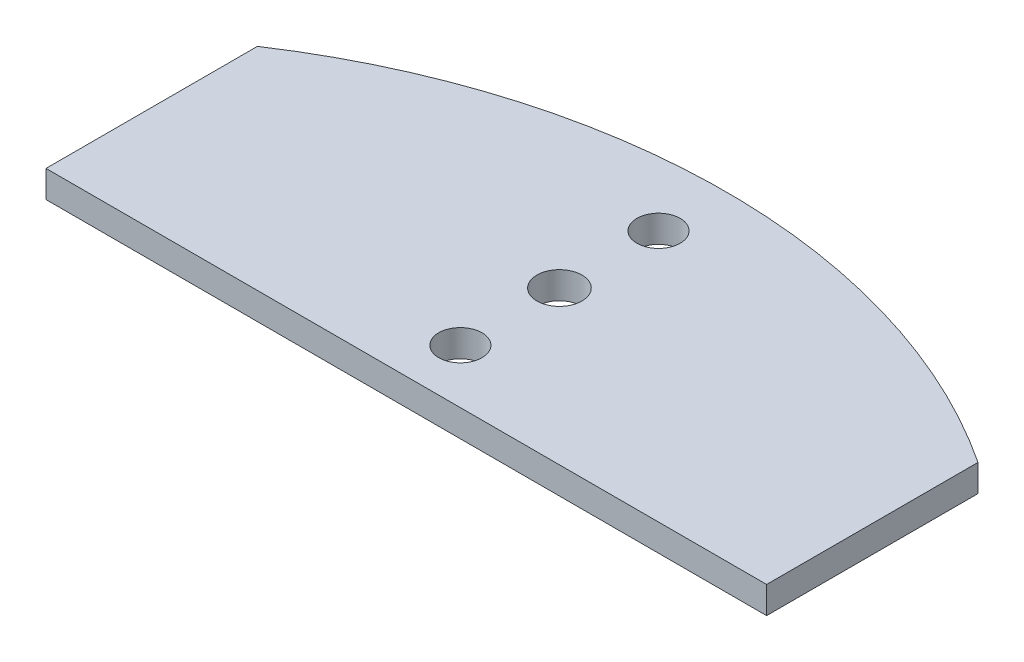
from build123d import *

# Parameters (mm, degrees)
BOSS_EXTRUDE1_DEPTH  = 3
SKETCH11_OUTSIDE_W   = 186.736
SKETCH11_OUTSIDE_H   = 177.534
SKETCH11_OUTSIDE_W_2 = 80
SKETCH11_OUTSIDE_H_2 = 40
CUT_EXTRUDE13_DEPTH  = 103.574363269
SKETCH12_R           = 2.4
CUT_EXTRUDE15_DEPTH  = 83.856804186
SKETCH13_R           = 2.5
CUT_EXTRUDE16_DEPTH  = 83.856804186


with BuildPart() as part:
    # Sketch1 → Boss-Extrude1 (new body)
    with BuildSketch(Plane(origin=(0, 0, 0), x_dir=(1, 0, 0), z_dir=(0, 1, 0))):
        with BuildLine():
            ThreePointArc((36.543377003, -62.616544118), (0, 72.5), (-36.543377003, -62.616544118))
            ThreePointArc((-36.543377003, -62.616544118), (-33.085954668, -63.20954405), (-30.089832649, -61.38507948))
            ThreePointArc((-30.089832649, -61.38507948), (0, -46.75), (30.089832649, -61.38507948))
            ThreePointArc((30.089832649, -61.38507948), (33.085954668, -63.20954405), (36.543377003, -62.616544118))
        make_face()
    extrude(amount=BOSS_EXTRUDE1_DEPTH)

    # Sketch11 outside → Cut-Extrude13 (cut, through all)
    with BuildSketch(Plane.XZ):
        with Locations((0, -4.601)):
            Rectangle(SKETCH11_OUTSIDE_W, SKETCH11_OUTSIDE_H)
        with Locations((0, -57)):
            Rectangle(SKETCH11_OUTSIDE_W_2, SKETCH11_OUTSIDE_H_2, mode=Mode.SUBTRACT)
    extrude(amount=-CUT_EXTRUDE13_DEPTH, mode=Mode.SUBTRACT)

    # Sketch12 → Cut-Extrude15 (cut, through all)
    with BuildSketch(Plane.XZ):
        with Locations(Location((0, -65, 0), (0, 0, 270))):
            Circle(SKETCH12_R)
        with Locations(Location((0, -43, 0), (0, 0, 270))):
            Circle(SKETCH12_R)
    extrude(amount=-CUT_EXTRUDE15_DEPTH, mode=Mode.SUBTRACT)

    # Sketch13 → Cut-Extrude16 (cut, through all)
    with BuildSketch(Plane.XZ):
        with Locations(Location((0, -54, 0), (0, 0, 270))):
            Circle(SKETCH13_R)
    extrude(amount=-CUT_EXTRUDE16_DEPTH, mode=Mode.SUBTRACT)


solid = part.part
